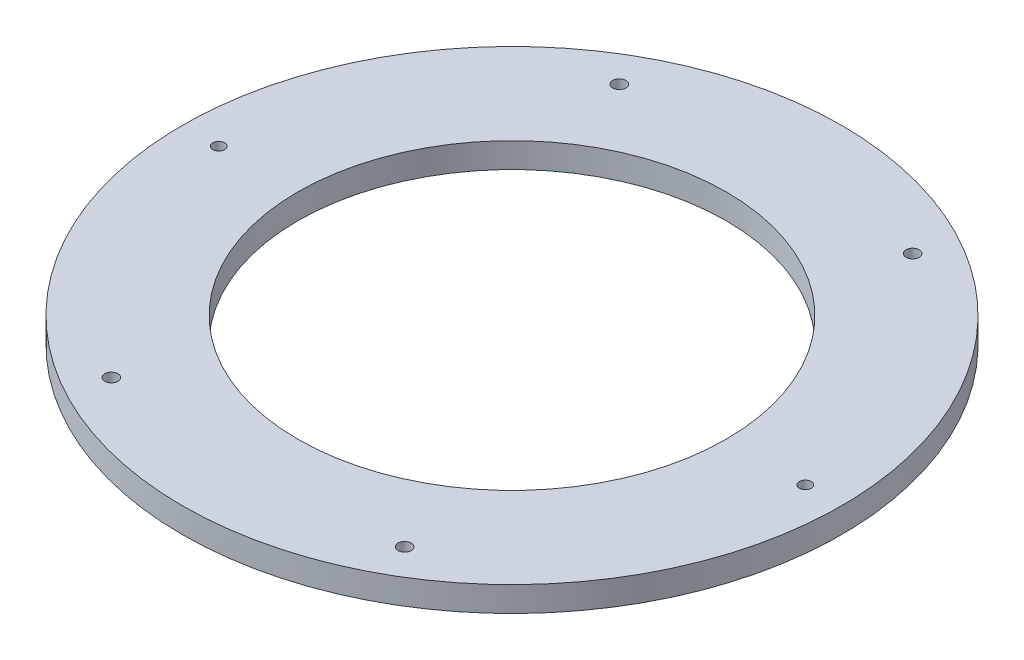
from build123d import *

# Parameters (mm, degrees)
SKETCH1_R           = 250
SKETCH1_R_2         = 162.5
BOSS_EXTRUDE1_DEPTH = 9.5
SKETCH2_R           = 5
SKETCH2_R_2         = 4.5
CUT_EXTRUDE1_DEPTH  = 355.063553617


with BuildPart() as part:
    # Sketch1 → Boss-Extrude1 (new, symmetric)
    with BuildSketch(Plane(origin=(0, 0, 0), x_dir=(1, 0, 0), z_dir=(0, 1, 0))):
        with Locations(Location((0, 0, 0), (0, 0, 270))):
            Circle(SKETCH1_R)
        with Locations(Location((0, 0, 0), (0, 0, 270))):
            Circle(SKETCH1_R_2, mode=Mode.SUBTRACT)
    extrude(amount=BOSS_EXTRUDE1_DEPTH, both=True)

    # Sketch2 → Cut-Extrude1 (cut, through all)
    with BuildSketch(Plane(origin=(0, 9.5, 0), x_dir=(1, 0, 0), z_dir=(0, 1, 0))):
        with Locations(Location((-111.25, 192.690652342, 0), (0, 0, 270))):
            Circle(SKETCH2_R)
        with Locations(Location((111.25, 192.690652342, 0), (0, 0, 270))):
            Circle(SKETCH2_R)
        with Locations(Location((222.5, 0, 0), (0, 0, 270))):
            Circle(SKETCH2_R_2)
        with Locations(Location((-111.25, -192.690652342, 0), (0, 0, 90))):
            Circle(SKETCH2_R)
        with Locations(Location((-222.5, 0, 0), (0, 0, 90))):
            Circle(SKETCH2_R_2)
        with Locations(Location((111.25, -192.690652342, 0), (0, 0, 90))):
            Circle(SKETCH2_R)
    extrude(amount=-CUT_EXTRUDE1_DEPTH, mode=Mode.SUBTRACT)


solid = part.part
